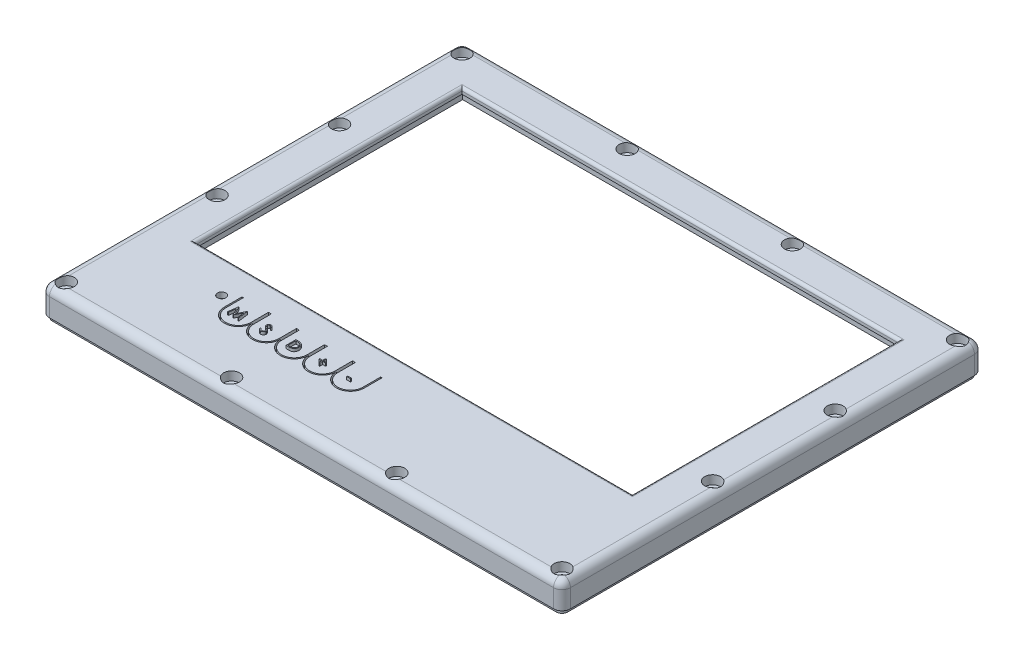
from build123d import *

# Parameters (mm, degrees)
SKETCH1_W           = 164.87
SKETCH1_H           = 104.3
SKETCH1_W_2         = 154.97
SKETCH1_H_2         = 94.47
BOSS_EXTRUDE1_DEPTH = 11
CUT_EXTRUDE1_START  = -11
SKETCH1_3_W         = 164.87
SKETCH1_3_H         = 104.3
SKETCH1_3_W_2       = 154.97
SKETCH1_3_H_2       = 94.47
CUT_EXTRUDE1_DEPTH  = 9
FILLET1_R           = 3
FILLET2_R           = 1
SKETCH2_W           = 3.67
SKETCH2_H           = 12.5
CUT_EXTRUDE2_DEPTH  = 6.87
CUT_EXTRUDE3_REACH  = 229.299
SKETCH2_4_R         = 1.6
SKETCH3_W           = 22
SKETCH3_H           = 6.55
SKETCH3_W_2         = 83.11
SKETCH3_H_2         = 18.45
CUT_EXTRUDE4_DEPTH  = 9
CUT_EXTRUDE5_REACH  = 229.211
SKETCH4_R           = 1.5
SKETCH5_R           = 3.225
SKETCH5_R_2         = 1.725
BOSS_EXTRUDE2_DEPTH = 7.5
BOSS_EXTRUDE3_START = 7.5
SKETCH5_4_R         = 1.725
BOSS_EXTRUDE3_DEPTH = 1.5
CUT_EXTRUDE6_DEPTH  = 2.86
SKETCH6_3_R         = 2.15
BOSS_EXTRUDE5_DEPTH = 2.86
SKETCH7_W           = 1.346153846
SKETCH7_H           = 0.358974359
BOSS_EXTRUDE6_DEPTH = 1
SKETCH8_W           = 78.76
SKETCH8_H           = 18.45
CUT_EXTRUDE7_DEPTH  = 8
SKETCH9_R           = 2.825
CUT_EXTRUDE8_DEPTH  = 3.13
CUT_EXTRUDE9_START  = -1.5
CUT_EXTRUDE9_DEPTH  = 1.5


with BuildPart() as part:
    # Sketch1 → Boss-Extrude1 (new body)
    # profile 1 of 2: a face of its own
    with BuildSketch(Plane(origin=(0, 0, 0), x_dir=(1, 0, 0), z_dir=(0, 1, 0))):
        with BuildLine():
            ThreePointArc((174.2, 7.54), (176.321320344, 6.661320344), (177.2, 4.54))
            Line((177.2, 4.54), (177.2, -138.93))
            ThreePointArc((177.2, -138.93), (176.321320344, -141.051320344), (174.2, -141.93))
            Line((174.2, -141.93), (-4.77, -141.93))
            ThreePointArc((-4.77, -141.93), (-6.891320344, -141.051320344), (-7.77, -138.93))
            Line((-7.77, -138.93), (-7.77, 4.54))
            ThreePointArc((-7.77, 4.54), (-6.891320344, 6.661320344), (-4.77, 7.54))
            Line((-4.77, 7.54), (174.2, 7.54))
        make_face()
        with Locations((82.435, -52.15)):
            Rectangle(SKETCH1_W, SKETCH1_H, mode=Mode.SUBTRACT)
    # profile 2 of 2: a face of its own
    with BuildSketch(Plane(origin=(0, 0, 0), x_dir=(1, 0, 0), z_dir=(0, 1, 0))):
        with Locations((82.435, -52.15)):
            Rectangle(SKETCH1_W, SKETCH1_H)
        with Locations((84.715, -54.695)):
            Rectangle(SKETCH1_W_2, SKETCH1_H_2, mode=Mode.SUBTRACT)
    extrude(amount=-BOSS_EXTRUDE1_DEPTH)

    # Sketch1<3> → Cut-Extrude1 (cut)
    with BuildSketch(Plane(origin=(0, 0, 0), x_dir=(1, 0, 0), z_dir=(0, 1, 0)).offset(CUT_EXTRUDE1_START)):
        with Locations((82.435, -52.15)):
            Rectangle(SKETCH1_3_W, SKETCH1_3_H)
        with Locations((84.715, -54.695)):
            Rectangle(SKETCH1_3_W_2, SKETCH1_3_H_2, mode=Mode.SUBTRACT)
    extrude(amount=CUT_EXTRUDE1_DEPTH, mode=Mode.SUBTRACT)

    # Fillet1
    fillet1_edges = [part.edges().sort_by_distance(p)[0] for p in [
        (177.2, 0, 67.195),
        (176.321320344, 0, 141.051320344),
        (84.715, 0, 141.93),
        (-6.891320344, 0, 141.051320344),
        (-7.77, 0, 67.195),
        (-6.891320344, 0, -6.661320344),
        (84.715, 0, -7.54),
        (176.321320344, 0, -6.661320344),
    ]]
    fillet(fillet1_edges, radius=FILLET1_R)

    # Fillet2
    fillet2_edges = [part.edges().sort_by_distance(p)[0] for p in [
        (7.23, 0, 54.695),
        (84.715, 0, 101.93),
        (162.2, 0, 54.695),
        (84.715, 0, 7.46),
    ]]
    fillet(fillet2_edges, radius=FILLET2_R)

    # Sketch2 → Cut-Extrude2 (cut)
    with BuildSketch(Plane.XZ.offset(11)):
        with Locations((166.705, 6.25)):
            Rectangle(SKETCH2_W, SKETCH2_H)
    extrude(amount=-CUT_EXTRUDE2_DEPTH, mode=Mode.SUBTRACT)

    # Sketch2<4> → Cut-Extrude3 (cut, up to next)
    with BuildSketch(Plane.XZ.offset(11), mode=Mode.PRIVATE) as cut_extrude3_sk1:
        with Locations(Location((172.7, -3.04, 0), (0, 0, 270))):
            Circle(SKETCH2_4_R)
    cut_extrude3_tool1 = extrude(cut_extrude3_sk1.sketch, amount=-CUT_EXTRUDE3_REACH, mode=Mode.PRIVATE) & part.part
    # Sketch2<4> → Cut-Extrude3 (cut, up to next)
    with BuildSketch(Plane.XZ.offset(11), mode=Mode.PRIVATE) as cut_extrude3_sk2:
        with Locations(Location((114.05, -3.04, 0), (0, 0, 270))):
            Circle(SKETCH2_4_R)
    cut_extrude3_tool2 = extrude(cut_extrude3_sk2.sketch, amount=-CUT_EXTRUDE3_REACH, mode=Mode.PRIVATE) & part.part
    # Sketch2<4> → Cut-Extrude3 (cut, up to next)
    with BuildSketch(Plane.XZ.offset(11), mode=Mode.PRIVATE) as cut_extrude3_sk3:
        with Locations(Location((-3.27, -3.04, 0), (0, 0, 270))):
            Circle(SKETCH2_4_R)
    cut_extrude3_tool3 = extrude(cut_extrude3_sk3.sketch, amount=-CUT_EXTRUDE3_REACH, mode=Mode.PRIVATE) & part.part
    # Sketch2<4> → Cut-Extrude3 (cut, up to next)
    with BuildSketch(Plane.XZ.offset(11), mode=Mode.PRIVATE) as cut_extrude3_sk4:
        with Locations(Location((-3.27, 83.94, 0), (0, 0, 270))):
            Circle(SKETCH2_4_R)
    cut_extrude3_tool4 = extrude(cut_extrude3_sk4.sketch, amount=-CUT_EXTRUDE3_REACH, mode=Mode.PRIVATE) & part.part
    # Sketch2<4> → Cut-Extrude3 (cut, up to next)
    with BuildSketch(Plane.XZ.offset(11), mode=Mode.PRIVATE) as cut_extrude3_sk5:
        with Locations(Location((-3.27, 137.43, 0), (0, 0, 270))):
            Circle(SKETCH2_4_R)
    cut_extrude3_tool5 = extrude(cut_extrude3_sk5.sketch, amount=-CUT_EXTRUDE3_REACH, mode=Mode.PRIVATE) & part.part
    # Sketch2<4> → Cut-Extrude3 (cut, up to next)
    with BuildSketch(Plane.XZ.offset(11), mode=Mode.PRIVATE) as cut_extrude3_sk6:
        with Locations(Location((55.38, 137.43, 0), (0, 0, 270))):
            Circle(SKETCH2_4_R)
    cut_extrude3_tool6 = extrude(cut_extrude3_sk6.sketch, amount=-CUT_EXTRUDE3_REACH, mode=Mode.PRIVATE) & part.part
    # Sketch2<4> → Cut-Extrude3 (cut, up to next)
    with BuildSketch(Plane.XZ.offset(11), mode=Mode.PRIVATE) as cut_extrude3_sk7:
        with Locations(Location((114.05, 137.43, 0), (0, 0, 270))):
            Circle(SKETCH2_4_R)
    cut_extrude3_tool7 = extrude(cut_extrude3_sk7.sketch, amount=-CUT_EXTRUDE3_REACH, mode=Mode.PRIVATE) & part.part
    # Sketch2<4> → Cut-Extrude3 (cut, up to next)
    with BuildSketch(Plane.XZ.offset(11), mode=Mode.PRIVATE) as cut_extrude3_sk8:
        with Locations(Location((172.7, 137.43, 0), (0, 0, 270))):
            Circle(SKETCH2_4_R)
    cut_extrude3_tool8 = extrude(cut_extrude3_sk8.sketch, amount=-CUT_EXTRUDE3_REACH, mode=Mode.PRIVATE) & part.part
    # Sketch2<4> → Cut-Extrude3 (cut, up to next)
    with BuildSketch(Plane.XZ.offset(11), mode=Mode.PRIVATE) as cut_extrude3_sk9:
        with Locations(Location((172.7, 83.94, 0), (0, 0, 270))):
            Circle(SKETCH2_4_R)
    cut_extrude3_tool9 = extrude(cut_extrude3_sk9.sketch, amount=-CUT_EXTRUDE3_REACH, mode=Mode.PRIVATE) & part.part
    # Sketch2<4> → Cut-Extrude3 (cut, up to next)
    with BuildSketch(Plane.XZ.offset(11), mode=Mode.PRIVATE) as cut_extrude3_sk10:
        with Locations(Location((172.7, 40.45, 0), (0, 0, 270))):
            Circle(SKETCH2_4_R)
    cut_extrude3_tool10 = extrude(cut_extrude3_sk10.sketch, amount=-CUT_EXTRUDE3_REACH, mode=Mode.PRIVATE) & part.part
    # Sketch2<4> → Cut-Extrude3 (cut, up to next)
    with BuildSketch(Plane.XZ.offset(11), mode=Mode.PRIVATE) as cut_extrude3_sk11:
        with Locations(Location((55.38, -3.04, 0), (0, 0, 270))):
            Circle(SKETCH2_4_R)
    cut_extrude3_tool11 = extrude(cut_extrude3_sk11.sketch, amount=-CUT_EXTRUDE3_REACH, mode=Mode.PRIVATE) & part.part
    # Sketch2<4> → Cut-Extrude3 (cut, up to next)
    with BuildSketch(Plane.XZ.offset(11), mode=Mode.PRIVATE) as cut_extrude3_sk12:
        with Locations(Location((-3.27, 40.45, 0), (0, 0, 270))):
            Circle(SKETCH2_4_R)
    cut_extrude3_tool12 = extrude(cut_extrude3_sk12.sketch, amount=-CUT_EXTRUDE3_REACH, mode=Mode.PRIVATE) & part.part
    add(cut_extrude3_tool1.solids().sort_by_distance((172.7, -11, -3.04))[0], mode=Mode.SUBTRACT)
    add(cut_extrude3_tool2.solids().sort_by_distance((114.05, -11, -3.04))[0], mode=Mode.SUBTRACT)
    add(cut_extrude3_tool3.solids().sort_by_distance((-3.27, -11, -3.04))[0], mode=Mode.SUBTRACT)
    add(cut_extrude3_tool4.solids().sort_by_distance((-3.27, -11, 83.94))[0], mode=Mode.SUBTRACT)
    add(cut_extrude3_tool5.solids().sort_by_distance((-3.27, -11, 137.43))[0], mode=Mode.SUBTRACT)
    add(cut_extrude3_tool6.solids().sort_by_distance((55.38, -11, 137.43))[0], mode=Mode.SUBTRACT)
    add(cut_extrude3_tool7.solids().sort_by_distance((114.05, -11, 137.43))[0], mode=Mode.SUBTRACT)
    add(cut_extrude3_tool8.solids().sort_by_distance((172.7, -11, 137.43))[0], mode=Mode.SUBTRACT)
    add(cut_extrude3_tool9.solids().sort_by_distance((172.7, -11, 83.94))[0], mode=Mode.SUBTRACT)
    add(cut_extrude3_tool10.solids().sort_by_distance((172.7, -11, 40.45))[0], mode=Mode.SUBTRACT)
    add(cut_extrude3_tool11.solids().sort_by_distance((55.38, -11, -3.04))[0], mode=Mode.SUBTRACT)
    add(cut_extrude3_tool12.solids().sort_by_distance((-3.27, -11, 40.45))[0], mode=Mode.SUBTRACT)

    # Sketch3 → Cut-Extrude4 (cut)
    with BuildSketch(Plane(origin=(0, -11, 0), x_dir=(-1, 0, 0), z_dir=(0, -1, 0))):
        with Locations((-11, -107.575)):
            Rectangle(SKETCH3_W, SKETCH3_H)
        with Locations((-41.555, -120.075)):
            Rectangle(SKETCH3_W_2, SKETCH3_H_2)
    extrude(amount=-CUT_EXTRUDE4_DEPTH, mode=Mode.SUBTRACT)

    # Sketch4 → Cut-Extrude5 (cut, up to next)
    with BuildSketch(Plane.XZ.offset(2), mode=Mode.PRIVATE) as cut_extrude5_sk1:
        with Locations(Location((28.4, 113.96, 0), (0, 0, 270))):
            Circle(SKETCH4_R)
    cut_extrude5_tool1 = extrude(cut_extrude5_sk1.sketch, amount=-CUT_EXTRUDE5_REACH, mode=Mode.PRIVATE) & part.part
    add(cut_extrude5_tool1.solids().sort_by_distance((28.4, -2, 113.96))[0], mode=Mode.SUBTRACT)

    # Sketch5 → Boss-Extrude2 (add)
    # profile 1 of 4: a face of its own
    with BuildSketch(Plane.XZ.offset(2)):
        with Locations(Location((4.99, 125.22, 0), (0, 0, 90))):
            Circle(SKETCH5_R)
        with Locations((4.99, 125.22)):
            Circle(SKETCH5_R_2, mode=Mode.SUBTRACT)
    # profile 2 of 4: a face of its own
    with BuildSketch(Plane.XZ.offset(2)):
        with Locations((4.99, 125.22)):
            Circle(SKETCH5_R_2)
    # profile 3 of 4: a face of its own
    with BuildSketch(Plane.XZ.offset(2)):
        with Locations(Location((79.79, 125.22, 0), (0, 0, 90))):
            Circle(SKETCH5_R)
        with Locations((79.79, 125.22)):
            Circle(SKETCH5_R_2, mode=Mode.SUBTRACT)
    # profile 4 of 4: a face of its own
    with BuildSketch(Plane.XZ.offset(2)):
        with Locations((79.79, 125.22)):
            Circle(SKETCH5_R_2)
    extrude(amount=BOSS_EXTRUDE2_DEPTH)

    # Sketch5<4> → Boss-Extrude3 (add)
    with BuildSketch(Plane.XZ.offset(2).offset(BOSS_EXTRUDE3_START)):
        with Locations(Location((79.79, 125.22, 0), (0, 0, 270))):
            Circle(SKETCH5_4_R)
        with Locations(Location((4.99, 125.22, 0), (0, 0, 270))):
            Circle(SKETCH5_4_R)
    extrude(amount=BOSS_EXTRUDE3_DEPTH)

    # Sketch6 → Cut-Extrude6 (cut)
    with BuildSketch(Plane.XZ.offset(2)):
        with BuildLine():
            Line((81.715, 117.095), (81.715, 110.85))
            Line((81.715, 110.85), (82.215, 110.85))
            Line((82.215, 110.85), (82.215, 117.095))
            ThreePointArc((82.215, 117.095), (80.759320702, 120.609320702), (77.245, 122.065))
            Line((77.245, 122.065), (77.235, 122.065))
            ThreePointArc((77.235, 122.065), (73.720679298, 120.609320702), (72.265, 117.095))
            Line((72.265, 117.095), (72.265, 110.85))
            Line((72.265, 110.85), (72.765, 110.85))
            Line((72.765, 110.85), (72.765, 117.095))
            ThreePointArc((72.765, 117.095), (74.074232688, 120.255767312), (77.235, 121.565))
            Line((77.235, 121.565), (77.245, 121.565))
            ThreePointArc((77.245, 121.565), (80.405767312, 120.255767312), (81.715, 117.095))
        make_face()
        with BuildLine():
            Line((71.765, 110.85), (72.265, 110.85))
            Line((72.265, 110.85), (72.265, 117.095))
            ThreePointArc((72.265, 117.095), (70.809320702, 120.609320702), (67.295, 122.065))
            Line((67.295, 122.065), (67.285, 122.065))
            ThreePointArc((67.285, 122.065), (63.770679298, 120.609320702), (62.315, 117.095))
            Line((62.315, 117.095), (62.315, 110.85))
            Line((62.315, 110.85), (62.815, 110.85))
            Line((62.815, 110.85), (62.815, 117.095))
            ThreePointArc((62.815, 117.095), (64.124232688, 120.255767312), (67.285, 121.565))
            Line((67.285, 121.565), (67.295, 121.565))
            ThreePointArc((67.295, 121.565), (70.455767312, 120.255767312), (71.765, 117.095))
            Line((71.765, 117.095), (71.765, 110.85))
        make_face()
        with BuildLine():
            Line((61.815, 110.85), (62.315, 110.85))
            Line((62.315, 110.85), (62.315, 117.095))
            ThreePointArc((62.315, 117.095), (60.859320702, 120.609320702), (57.345, 122.065))
            Line((57.345, 122.065), (57.335, 122.065))
            ThreePointArc((57.335, 122.065), (53.820679298, 120.609320702), (52.365, 117.095))
            Line((52.365, 117.095), (52.365, 110.85))
            Line((52.365, 110.85), (52.865, 110.85))
            Line((52.865, 110.85), (52.865, 117.095))
            ThreePointArc((52.865, 117.095), (54.174232688, 120.255767312), (57.335, 121.565))
            Line((57.335, 121.565), (57.345, 121.565))
            ThreePointArc((57.345, 121.565), (60.505767312, 120.255767312), (61.815, 117.095))
            Line((61.815, 117.095), (61.815, 110.85))
        make_face()
        with BuildLine():
            Line((51.865, 110.85), (52.365, 110.85))
            Line((52.365, 110.85), (52.365, 117.095))
            ThreePointArc((52.365, 117.095), (50.909320702, 120.609320702), (47.395, 122.065))
            Line((47.395, 122.065), (47.385, 122.065))
            ThreePointArc((47.385, 122.065), (43.870679298, 120.609320702), (42.415, 117.095))
            Line((42.415, 117.095), (42.415, 110.85))
            Line((42.415, 110.85), (42.915, 110.85))
            Line((42.915, 110.85), (42.915, 117.095))
            ThreePointArc((42.915, 117.095), (44.224232688, 120.255767312), (47.385, 121.565))
            Line((47.385, 121.565), (47.395, 121.565))
            ThreePointArc((47.395, 121.565), (50.555767312, 120.255767312), (51.865, 117.095))
            Line((51.865, 117.095), (51.865, 110.85))
        make_face()
        with BuildLine():
            Line((41.915, 110.85), (42.415, 110.85))
            Line((42.415, 110.85), (42.415, 117.095))
            ThreePointArc((42.415, 117.095), (40.959320702, 120.609320702), (37.445, 122.065))
            Line((37.445, 122.065), (37.435, 122.065))
            ThreePointArc((37.435, 122.065), (33.920679298, 120.609320702), (32.465, 117.095))
            Line((32.465, 117.095), (32.465, 110.85))
            Line((32.465, 110.85), (32.965, 110.85))
            Line((32.965, 110.85), (32.965, 117.095))
            ThreePointArc((32.965, 117.095), (34.274232688, 120.255767312), (37.435, 121.565))
            Line((37.435, 121.565), (37.445, 121.565))
            ThreePointArc((37.445, 121.565), (40.605767312, 120.255767312), (41.915, 117.095))
            Line((41.915, 117.095), (41.915, 110.85))
        make_face()
    extrude(amount=-CUT_EXTRUDE6_DEPTH, mode=Mode.SUBTRACT)

    # Sketch6<3> → Boss-Extrude5 (add)
    with BuildSketch(Plane.XZ.offset(2)):
        with Locations(Location((77.24, 117.09, 0), (0, 0, 90))):
            Circle(SKETCH6_3_R)
        with Locations(Location((67.29, 117.09, 0), (0, 0, 90))):
            Circle(SKETCH6_3_R)
        with Locations(Location((57.34, 117.09, 0), (0, 0, 90))):
            Circle(SKETCH6_3_R)
        with Locations(Location((47.39, 117.09, 0), (0, 0, 90))):
            Circle(SKETCH6_3_R)
        with Locations(Location((37.44, 117.09, 0), (0, 0, 90))):
            Circle(SKETCH6_3_R)
    extrude(amount=BOSS_EXTRUDE5_DEPTH)

    # Sketch7 → Boss-Extrude6 (add)
    # profile 1 of 5: a face of its own
    with BuildSketch(Plane(origin=(0, 0, 0), x_dir=(1, 0, 0), z_dir=(0, 1, 0))):
        Polygon((35.475783419, -118.892076783), (35.937822682, -115.392076783), (35.982694477, -115.392076783), (37.427706496, -118.263871655), (38.869212906, -115.392076783), (38.914785823, -115.392076783), (39.379629573, -118.892076783), (39.064124765, -118.892076783), (38.728988547, -116.373647296), (37.465567073, -118.892076783), (37.394753772, -118.892076783), (36.126424445, -116.368038322), (35.791989349, -118.892076783), align=None)
    # profile 2 of 5: a face of its own
    with BuildSketch(Plane(origin=(0, 0, 0), x_dir=(1, 0, 0), z_dir=(0, 1, 0))):
        with BuildLine():
            Line((46.215238116, -118.216896495), (46.511111513, -118.039512681))
            add(Edge.make_bspline(
                [(46.511111513, -118.039512681), (46.53862975, -118.085577066), (46.591353631, -118.173834649), (46.67930499, -118.29309269), (46.770437901, -118.394454847), (46.865427235, -118.477331454), (46.963693183, -118.542580341), (47.065877237, -118.588782573), (47.171635047, -118.617598548), (47.243608869, -118.621098635), (47.279541, -118.622846014)],
                knots=[0, 0, 0, 0, 1.272034388, 2.437168799, 3.508375237, 4.49857839, 5.41946034, 6.295179144, 7.148887113, 8, 8, 8, 8], degree=3))
            add(Edge.make_bspline(
                [(47.279541, -118.622846014), (47.310227861, -118.621991341), (47.371064634, -118.620296951), (47.460626877, -118.604016149), (47.547608679, -118.57900402), (47.630217317, -118.543183089), (47.707312931, -118.499844603), (47.774919627, -118.447498425), (47.83336574, -118.38889222), (47.881174854, -118.323509565), (47.91785489, -118.253192416), (47.946046958, -118.181016465), (47.961692032, -118.105847897), (47.964048785, -118.055237434), (47.965238116, -118.029696975)],
                knots=[0, 0, 0, 0, 1.095163259, 2.171163733, 3.241058638, 4.321873601, 5.38011039, 6.391990106, 7.366004449, 8.327778327, 9.272591725, 10.192022065, 11.087607919, 12, 12, 12, 12], degree=3))
            add(Edge.make_bspline(
                [(47.965238116, -118.029696975), (47.963763805, -118.000556126), (47.960766747, -117.941317037), (47.935435267, -117.853917384), (47.89558602, -117.767424814), (47.858823376, -117.713923548), (47.839737314, -117.686147296)],
                knots=[0, 0, 0, 0, 0.938893495, 1.908633276, 2.914225137, 4, 4, 4, 4], degree=3))
            add(Edge.make_bspline(
                [(47.839737314, -117.686147296), (47.8240667, -117.666100472), (47.791168206, -117.624014674), (47.734610693, -117.561369438), (47.668244579, -117.496751019), (47.594341024, -117.427691962), (47.510207935, -117.357404166), (47.418480421, -117.282535888), (47.316816562, -117.205934311), (47.245517065, -117.154561745), (47.208727699, -117.128054347)],
                knots=[0, 0, 0, 0, 0.722233717, 1.516239348, 2.393582979, 3.351407094, 4.387010283, 5.505090956, 6.712668013, 8, 8, 8, 8], degree=3))
            add(Edge.make_bspline(
                [(47.208727699, -117.128054347), (47.171903703, -117.10182576), (47.101499026, -117.051678697), (47.003040444, -116.977254413), (46.914995981, -116.909210544), (46.837756964, -116.846906532), (46.771357367, -116.790333927), (46.715273956, -116.740035988), (46.670935399, -116.694652427), (46.646279819, -116.665211085), (46.635210071, -116.651992649)],
                knots=[0, 0, 0, 0, 1.452282411, 2.77665338, 3.964542531, 5.026858415, 5.96415736, 6.766646006, 7.446254459, 8, 8, 8, 8], degree=3))
            add(Edge.make_bspline(
                [(46.635210071, -116.651992649), (46.619737526, -116.631391612), (46.589308689, -116.590876908), (46.549142683, -116.52755205), (46.515003521, -116.462728785), (46.488241188, -116.39623292), (46.46570497, -116.328997991), (46.450547039, -116.260146746), (46.441055642, -116.189988127), (46.440083655, -116.142774626), (46.43959709, -116.119140084)],
                knots=[0, 0, 0, 0, 1.068054152, 2.10047183, 3.106115577, 4.101338837, 5.06977816, 6.043150881, 7.020423561, 8, 8, 8, 8], degree=3))
            add(Edge.make_bspline(
                [(46.43959709, -116.119140084), (46.440902299, -116.08211031), (46.443484819, -116.008842246), (46.465325336, -115.901811416), (46.49979823, -115.799624998), (46.548093118, -115.703294665), (46.610350471, -115.615328684), (46.682396445, -115.534715197), (46.768207931, -115.466946615), (46.862360555, -115.407734556), (46.965416927, -115.361388631), (47.07340783, -115.326427651), (47.186504902, -115.306618393), (47.263108037, -115.303775628), (47.301976898, -115.302333193)],
                knots=[0, 0, 0, 0, 1.005424448, 1.989358655, 2.955360095, 3.929531133, 4.905563448, 5.876582895, 6.856512386, 7.866279853, 8.892233794, 9.918561126, 10.94386622, 12, 12, 12, 12], degree=3))
            add(Edge.make_bspline(
                [(47.301976898, -115.302333193), (47.343220998, -115.303755745), (47.42524235, -115.306584746), (47.545891565, -115.331182277), (47.662052282, -115.371882949), (47.755495547, -115.418071607), (47.828628308, -115.464203023), (47.884401041, -115.506222847), (47.940918491, -115.554597956), (47.998636546, -115.609457202), (48.056577206, -115.671303953), (48.115600658, -115.739714642), (48.175844927, -115.814271198), (48.214600787, -115.867495698), (48.234468885, -115.89478111)],
                knots=[0, 0, 0, 0, 1.286793592, 2.559021753, 3.825965368, 5.121522368, 5.803751409, 6.523245864, 7.299691795, 8.125521123, 9.008227632, 9.944561021, 10.946284179, 12, 12, 12, 12], degree=3))
            Line((48.234468885, -115.89478111), (47.950514558, -116.110025501))
            add(Edge.make_bspline(
                [(47.950514558, -116.110025501), (47.933368625, -116.087936811), (47.900349568, -116.045399157), (47.850220082, -115.985827842), (47.802971434, -115.931411362), (47.756421034, -115.884146234), (47.713027402, -115.841444101), (47.67091036, -115.804884344), (47.630676009, -115.774108749), (47.579959098, -115.741265189), (47.51624138, -115.708708685), (47.436256844, -115.681159607), (47.352670569, -115.664604545), (47.295740937, -115.662415658), (47.266920808, -115.661307552)],
                knots=[0, 0, 0, 0, 1.181633172, 2.275549214, 3.290209073, 4.226197932, 5.078386478, 5.862611352, 6.581680152, 7.217281963, 8.414376989, 9.595101626, 10.782541182, 12, 12, 12, 12], degree=3))
            add(Edge.make_bspline(
                [(47.266920808, -115.661307552), (47.230764286, -115.662519252), (47.161039838, -115.664855902), (47.062049602, -115.690375887), (46.972955677, -115.730557747), (46.896403112, -115.786872725), (46.832666135, -115.853593718), (46.786560676, -115.930372573), (46.758810512, -116.015154976), (46.755424232, -116.074296632), (46.753699654, -116.104416527)],
                knots=[0, 0, 0, 0, 1.14458467, 2.207223713, 3.21896685, 4.227309161, 5.202851033, 6.127160689, 7.046193047, 8, 8, 8, 8], degree=3))
            add(Edge.make_bspline(
                [(46.753699654, -116.104416527), (46.754092781, -116.123168005), (46.754879677, -116.160701625), (46.765854475, -116.216153047), (46.779953803, -116.271464386), (46.802296435, -116.326386969), (46.833141739, -116.381881328), (46.873646915, -116.438903066), (46.924660227, -116.497954774), (46.963737239, -116.536362148), (46.984368725, -116.556640084)],
                knots=[0, 0, 0, 0, 0.858281714, 1.717966888, 2.583508476, 3.4729293, 4.427298488, 5.488583878, 6.674047936, 8, 8, 8, 8], degree=3))
            add(Edge.make_bspline(
                [(46.984368725, -116.556640084), (46.992030097, -116.56347711), (47.010231764, -116.579720319), (47.04350769, -116.606312599), (47.087450488, -116.639115371), (47.140912689, -116.679702688), (47.204880051, -116.72678415), (47.279359607, -116.779757762), (47.36352114, -116.840343221), (47.423243056, -116.882700762), (47.454821449, -116.905097616)],
                knots=[0, 0, 0, 0, 0.420754252, 0.999615792, 1.744751191, 2.668019286, 3.750313428, 4.999500688, 6.413464383, 8, 8, 8, 8], degree=3))
            add(Edge.make_bspline(
                [(47.454821449, -116.905097616), (47.492807362, -116.932738976), (47.566361819, -116.986262638), (47.671019399, -117.066678318), (47.765913207, -117.145326086), (47.85137641, -117.221703693), (47.928253319, -117.295231786), (47.995691039, -117.366794967), (48.05437672, -117.435880539), (48.117555938, -117.524453115), (48.182113758, -117.633234199), (48.237555265, -117.766512438), (48.272513613, -117.900308758), (48.277085128, -117.990235595), (48.27934068, -118.034604828)],
                knots=[0, 0, 0, 0, 1.163667725, 2.253281268, 3.268753668, 4.215851969, 5.092017293, 5.902905408, 6.650798638, 7.335211899, 8.59617414, 9.77448103, 10.901945474, 12, 12, 12, 12], degree=3))
            add(Edge.make_bspline(
                [(48.27934068, -118.034604828), (48.278683542, -118.065983193), (48.277382027, -118.128130577), (48.262421113, -118.219385654), (48.240501448, -118.308016523), (48.207464214, -118.392927636), (48.167141055, -118.475672398), (48.115974808, -118.554080299), (48.056667123, -118.629886697), (47.988633358, -118.701070189), (47.914187456, -118.766416385), (47.835503761, -118.824545446), (47.752453488, -118.87301377), (47.665487171, -118.912564612), (47.574584835, -118.943498129), (47.479777051, -118.965910998), (47.38090754, -118.979666709), (47.313707058, -118.981094471), (47.279541, -118.981820373)],
                knots=[0, 0, 0, 0, 0.983748083, 1.948392443, 2.894712957, 3.844097841, 4.80183111, 5.778335162, 6.776009319, 7.81870978, 8.863265674, 9.881300176, 10.883814829, 11.87499822, 12.874611388, 13.892143829, 14.928324115, 16, 16, 16, 16], degree=3))
            add(Edge.make_bspline(
                [(47.279541, -118.981820373), (47.253105657, -118.981309191), (47.200567897, -118.980293266), (47.122858415, -118.971311985), (47.046718826, -118.958604882), (46.973104544, -118.938430812), (46.901067132, -118.913953835), (46.830919898, -118.883815502), (46.762628844, -118.847698301), (46.695811261, -118.806403276), (46.630637087, -118.758345532), (46.567717619, -118.702372035), (46.504988433, -118.64002653), (46.444301037, -118.569615967), (46.384427893, -118.492277884), (46.326549483, -118.407288701), (46.269467765, -118.315111347), (46.233652298, -118.250246261), (46.215238116, -118.216896495)],
                knots=[0, 0, 0, 0, 0.915332311, 1.819136955, 2.706846663, 3.586547465, 4.459518054, 5.340707479, 6.227863349, 7.133153174, 8.059268498, 9.028702269, 10.047606654, 11.120612155, 12.245963614, 13.433783089, 14.680604001, 16, 16, 16, 16], degree=3))
        make_face()
    # profile 3 of 5: a face of its own
    with BuildSketch(Plane(origin=(0, 0, 0), x_dir=(1, 0, 0), z_dir=(0, 1, 0))):
        with BuildLine():
            Line((56.19065615, -118.892076783), (56.19065615, -115.392076783))
            Line((56.19065615, -115.392076783), (56.89738692, -115.392076783))
            add(Edge.make_bspline(
                [(56.89738692, -115.392076783), (56.958855908, -115.392519353), (57.077613673, -115.393374396), (57.249226121, -115.398795787), (57.408009883, -115.408386253), (57.553442742, -115.422355779), (57.685923954, -115.439508813), (57.805082562, -115.461009217), (57.911534705, -115.486397388), (57.977004146, -115.508042838), (58.007963843, -115.518278706)],
                knots=[0, 0, 0, 0, 1.314313732, 2.53924729, 3.670748893, 4.714932338, 5.66265055, 6.526160246, 7.303039223, 8, 8, 8, 8], degree=3))
            add(Edge.make_bspline(
                [(58.007963843, -115.518278706), (58.048458582, -115.533709412), (58.128529774, -115.564220906), (58.242536897, -115.621777207), (58.34986226, -115.686990309), (58.451081405, -115.759946172), (58.543882231, -115.84271052), (58.631890128, -115.931767606), (58.711504852, -116.030355946), (58.784413148, -116.136430934), (58.850148807, -116.248742986), (58.907287965, -116.367078095), (58.954741958, -116.490835303), (58.994135185, -116.619670451), (59.025181642, -116.753866829), (59.046363574, -116.893580695), (59.060334564, -117.038259884), (59.061738615, -117.136434348), (59.062451022, -117.186247456)],
                knots=[0, 0, 0, 0, 0.984719456, 1.947108742, 2.898477687, 3.838006223, 4.779231079, 5.722358779, 6.681677486, 7.655904652, 8.64651281, 9.637519902, 10.640069247, 11.656948941, 12.698408672, 13.768548281, 14.867775369, 16, 16, 16, 16], degree=3))
            add(Edge.make_bspline(
                [(59.062451022, -117.186247456), (59.061822055, -117.229508695), (59.060582609, -117.314759484), (59.049453293, -117.440400379), (59.033276973, -117.562313951), (59.008232775, -117.679919651), (58.977830261, -117.794247869), (58.93886611, -117.904080113), (58.894230614, -118.010423922), (58.842180735, -118.111841398), (58.78503935, -118.20792477), (58.723717607, -118.298500299), (58.658280912, -118.38227552), (58.588105279, -118.459504132), (58.514097562, -118.530069711), (58.435773232, -118.594561726), (58.352930181, -118.651718281), (58.265939458, -118.703785389), (58.172263329, -118.749205745), (58.070127463, -118.787635755), (57.959096285, -118.81948237), (57.839442328, -118.846053266), (57.71095885, -118.867130568), (57.573519884, -118.881256961), (57.427336595, -118.890809893), (57.326957329, -118.891646287), (57.275291567, -118.892076783)],
                knots=[0, 0, 0, 0, 1.105936401, 2.179363191, 3.223086493, 4.248585256, 5.251745608, 6.245858792, 7.225916811, 8.198733463, 9.158002045, 10.082870192, 10.993790845, 11.873723703, 12.748670949, 13.606408763, 14.465103618, 15.319838547, 16.196477973, 17.123216899, 18.106603292, 19.147568657, 20.255746949, 21.433717677, 22.679120308, 24, 24, 24, 24], degree=3))
            Line((57.275291567, -118.892076783), (56.19065615, -118.892076783))
        make_face()
        with BuildLine():
            Line((56.504758714, -118.533102424), (56.906501503, -118.533102424))
            add(Edge.make_bspline(
                [(56.906501503, -118.533102424), (56.964229874, -118.532854328), (57.075262672, -118.532377148), (57.234920669, -118.528189944), (57.380800066, -118.521348007), (57.512921575, -118.511772929), (57.631210599, -118.499104314), (57.735914349, -118.484979411), (57.826689608, -118.46738196), (57.881619045, -118.451431001), (57.907002304, -118.444059956)],
                knots=[0, 0, 0, 0, 1.375205317, 2.645023457, 3.804390687, 4.853969522, 5.800190428, 6.637939096, 7.370582563, 8, 8, 8, 8], degree=3))
            add(Edge.make_bspline(
                [(57.907002304, -118.444059956), (57.938950666, -118.432808398), (58.002084304, -118.410574025), (58.09296539, -118.370016364), (58.177722394, -118.321974294), (58.25783242, -118.26857202), (58.332159075, -118.207926018), (58.401583191, -118.141355029), (58.465964993, -118.068520254), (58.524639301, -117.989512092), (58.577147605, -117.904822297), (58.622618834, -117.815283463), (58.662470366, -117.721876653), (58.693748958, -117.623167494), (58.718264542, -117.520038436), (58.73562923, -117.412482222), (58.746443955, -117.300518941), (58.747705403, -117.224366816), (58.748348458, -117.185546334)],
                knots=[0, 0, 0, 0, 0.998632004, 1.973411704, 2.929992603, 3.868527914, 4.809262121, 5.754881198, 6.702106254, 7.672490631, 8.653608572, 9.636854334, 10.631411391, 11.644891563, 12.686317036, 13.754757253, 14.855430412, 16, 16, 16, 16], degree=3))
            add(Edge.make_bspline(
                [(58.748348458, -117.185546334), (58.747835171, -117.144612854), (58.746826813, -117.06419867), (58.734152503, -116.946207974), (58.715630947, -116.832727324), (58.688847261, -116.723749129), (58.654716382, -116.619060776), (58.612121741, -116.519241266), (58.563455121, -116.423236397), (58.505551784, -116.333262032), (58.442136191, -116.248168922), (58.371758312, -116.170214007), (58.295536273, -116.099219707), (58.214301424, -116.034080394), (58.125764324, -115.977416718), (58.032010634, -115.926730037), (57.931664962, -115.883714146), (57.861852267, -115.860835283), (57.826373298, -115.849208193)],
                knots=[0, 0, 0, 0, 1.122418816, 2.205001699, 3.251619955, 4.274784885, 5.280384055, 6.268708349, 7.249350384, 8.229342522, 9.199999885, 10.157847722, 11.105861043, 12.055065948, 13.010012805, 13.98527497, 14.976112212, 16, 16, 16, 16], degree=3))
            add(Edge.make_bspline(
                [(57.826373298, -115.849208193), (57.797022151, -115.841091766), (57.734613561, -115.823834013), (57.632774097, -115.80500864), (57.518158948, -115.788404141), (57.390259247, -115.774346102), (57.249220787, -115.764258781), (57.094935099, -115.756687466), (56.927335495, -115.751580834), (56.811152961, -115.751232126), (56.750852464, -115.751051142)],
                knots=[0, 0, 0, 0, 0.674548936, 1.434276114, 2.292660221, 3.240891867, 4.284742987, 5.42552168, 6.663806718, 8, 8, 8, 8], degree=3))
            Line((56.750852464, -115.751051142), (56.504758714, -115.751051142))
            Line((56.504758714, -115.751051142), (56.504758714, -118.533102424))
        make_face(mode=Mode.SUBTRACT)
    # profile 4 of 5: a face of its own
    with BuildSketch(Plane(origin=(0, 0, 0), x_dir=(1, 0, 0), z_dir=(0, 1, 0))):
        Polygon((67.304719581, -117.007461399), (67.304719581, -115.975410116), (67.618822145, -115.975410116), (67.618822145, -117.007461399), (68.650873427, -117.007461399), (68.650873427, -117.321563963), (67.618822145, -117.321563963), (67.618822145, -118.353615245), (67.304719581, -118.353615245), (67.304719581, -117.321563963), (66.272668299, -117.321563963), (66.272668299, -117.007461399), align=None)
    # profile 5 of 5: a face of its own
    with BuildSketch(Plane(origin=(0, 0, 0), x_dir=(1, 0, 0), z_dir=(0, 1, 0))):
        with Locations((77.240265875, -117.545922937)):
            Rectangle(SKETCH7_W, SKETCH7_H)
    extrude(amount=BOSS_EXTRUDE6_DEPTH)

    # Sketch8 → Cut-Extrude7 (cut)
    with BuildSketch(Plane.XZ.offset(11)):
        with Locations((125.49, 120.075)):
            Rectangle(SKETCH8_W, SKETCH8_H)
    extrude(amount=-CUT_EXTRUDE7_DEPTH, mode=Mode.SUBTRACT)

    # Sketch9 → Cut-Extrude8 (cut)
    with BuildSketch(Plane(origin=(0, 0, 0), x_dir=(1, 0, 0), z_dir=(0, 1, 0))):
        with Locations(Location((-3.27, 3.04, 0), (0, 0, 270))):
            Circle(SKETCH9_R)
        with Locations(Location((55.38, 3.04, 0), (0, 0, 270))):
            Circle(SKETCH9_R)
        with Locations(Location((114.05, 3.04, 0), (0, 0, 270))):
            Circle(SKETCH9_R)
        with Locations(Location((172.7, 3.04, 0), (0, 0, 270))):
            Circle(SKETCH9_R)
        with Locations(Location((172.7, -40.45, 0), (0, 0, 270))):
            Circle(SKETCH9_R)
        with Locations(Location((172.7, -83.94, 0), (0, 0, 270))):
            Circle(SKETCH9_R)
        with Locations(Location((172.7, -137.43, 0), (0, 0, 270))):
            Circle(SKETCH9_R)
        with Locations(Location((114.05, -137.43, 0), (0, 0, 270))):
            Circle(SKETCH9_R)
        with Locations(Location((55.38, -137.43, 0), (0, 0, 270))):
            Circle(SKETCH9_R)
        with Locations(Location((-3.27, -137.43, 0), (0, 0, 270))):
            Circle(SKETCH9_R)
        with Locations(Location((-3.27, -83.94, 0), (0, 0, 270))):
            Circle(SKETCH9_R)
        with Locations(Location((-3.27, -40.45, 0), (0, 0, 270))):
            Circle(SKETCH9_R)
    extrude(amount=-CUT_EXTRUDE8_DEPTH, mode=Mode.SUBTRACT)

    # Sketch12 → Cut-Extrude9 (cut)
    with BuildSketch(Plane.XZ.offset(11).offset(CUT_EXTRUDE9_START)):
        with BuildLine():
            Line((-4.77, -7.54), (174.2, -7.54))
            ThreePointArc((174.2, -7.54), (176.321320344, -6.661320344), (177.2, -4.54))
            Line((177.2, -4.54), (177.2, 138.93))
            ThreePointArc((177.2, 138.93), (176.321320344, 141.051320344), (174.2, 141.93))
            Line((174.2, 141.93), (-4.77, 141.93))
            ThreePointArc((-4.77, 141.93), (-6.891320344, 141.051320344), (-7.77, 138.93))
            Line((-7.77, 138.93), (-7.77, -4.54))
            ThreePointArc((-7.77, -4.54), (-6.891320344, -6.661320344), (-4.77, -7.54))
        make_face()
        with BuildLine():
            Line((176.2, -4.54), (176.2, 138.93))
            ThreePointArc((176.2, 138.93), (175.614213562, 140.344213562), (174.2, 140.93))
            Line((174.2, 140.93), (-4.77, 140.93))
            ThreePointArc((-4.77, 140.93), (-6.184213562, 140.344213562), (-6.77, 138.93))
            Line((-6.77, 138.93), (-6.77, -4.54))
            ThreePointArc((-6.77, -4.54), (-6.184213562, -5.954213562), (-4.77, -6.54))
            Line((-4.77, -6.54), (174.2, -6.54))
            ThreePointArc((174.2, -6.54), (175.614213562, -5.954213562), (176.2, -4.54))
        make_face(mode=Mode.SUBTRACT)
    extrude(amount=CUT_EXTRUDE9_DEPTH, mode=Mode.SUBTRACT)


solid = part.part
